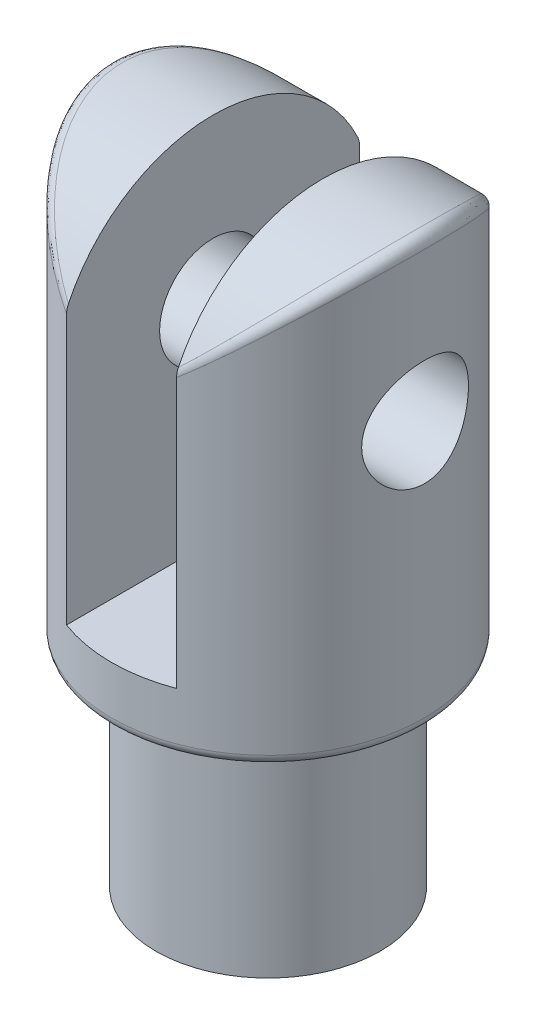
from build123d import *

# Parameters (mm, degrees)
SKETCH1_R               = 14.65
BOSS_EXTRUDE1_DEPTH     = 40
CUT_EXTRUDE1_DEPTH      = 19
CUT_EXTRUDE1_DEPTH_BACK = 19
SKETCH2_W               = 10.3
SKETCH2_H               = 37.939916677
CUT_EXTRUDE2_DEPTH      = 19
CUT_EXTRUDE2_DEPTH_BACK = 19
FILLET1_R               = 1
CUT_EXTRUDE3_DEPTH      = 19
CUT_EXTRUDE3_DEPTH_BACK = 19
SKETCH4_R               = 5
FILLET2_R               = 1
SKETCH5_R               = 10.5
BOSS_EXTRUDE2_DEPTH     = 20


with BuildPart() as part:
    # Sketch1 → Boss-Extrude1 (new body)
    with BuildSketch(Plane(origin=(0, 0, 0), x_dir=(1, 0, 0), z_dir=(0, 1, 0))):
        Circle(SKETCH1_R)
    extrude(amount=BOSS_EXTRUDE1_DEPTH)

    # Sketch2 → Cut-Extrude1 (cut, two sides: drawn at the far end of the back side and taken through both)
    with BuildSketch(Plane.XY.offset(-CUT_EXTRUDE1_DEPTH_BACK)):
        with Locations((0, 24.469958338)):
            Rectangle(SKETCH2_W, SKETCH2_H)
    extrude(amount=CUT_EXTRUDE1_DEPTH + CUT_EXTRUDE1_DEPTH_BACK, mode=Mode.SUBTRACT)

    # Sketch3 → Cut-Extrude2 (cut, two sides: drawn at the far end of the back side and taken through both)
    with BuildSketch(Plane(origin=(0, 0, 0), x_dir=(0, 0, -1), z_dir=(1, 0, 0)).offset(-CUT_EXTRUDE2_DEPTH_BACK)):
        with BuildLine():
            Line((-14.926622436, 23.518128666), (-17.131822149, 45.730707277))
            Line((-17.131822149, 45.730707277), (19.448630576, 46.784645891))
            Line((19.448630576, 46.784645891), (14.184159427, 29.879510359))
            ThreePointArc((14.184159427, 29.879510359), (-3.202281545, 39.654193697), (-14.926622436, 23.518128666))
        make_face()
    extrude(amount=CUT_EXTRUDE2_DEPTH + CUT_EXTRUDE2_DEPTH_BACK, mode=Mode.SUBTRACT)

    # Fillet1
    fillet1_edges = [part.edges().sort_by_distance(p)[0] for p in [
        (-14.650000008, 40.000000008, 0),
        (11.62782472, 37.065811525, -8.911576307),
    ]]
    fillet(fillet1_edges, radius=FILLET1_R)

    # Sketch4 → Cut-Extrude3 (cut, two sides: drawn at the far end of the back side and taken through both)
    with BuildSketch(Plane(origin=(0, 0, 0), x_dir=(0, 0, -1), z_dir=(1, 0, 0)).offset(-CUT_EXTRUDE3_DEPTH_BACK)):
        with Locations((0, 25)):
            Circle(SKETCH4_R)
    extrude(amount=CUT_EXTRUDE3_DEPTH + CUT_EXTRUDE3_DEPTH_BACK, mode=Mode.SUBTRACT)

    # Fillet2
    fillet2_edges = [part.edges().sort_by_distance(p)[0] for p in [
        (-14.65, 0, 0),
    ]]
    fillet(fillet2_edges, radius=FILLET2_R)

    # Sketch5 → Boss-Extrude2 (add)
    with BuildSketch(Plane.XZ):
        Circle(SKETCH5_R)
    extrude(amount=BOSS_EXTRUDE2_DEPTH)


solid = part.part
